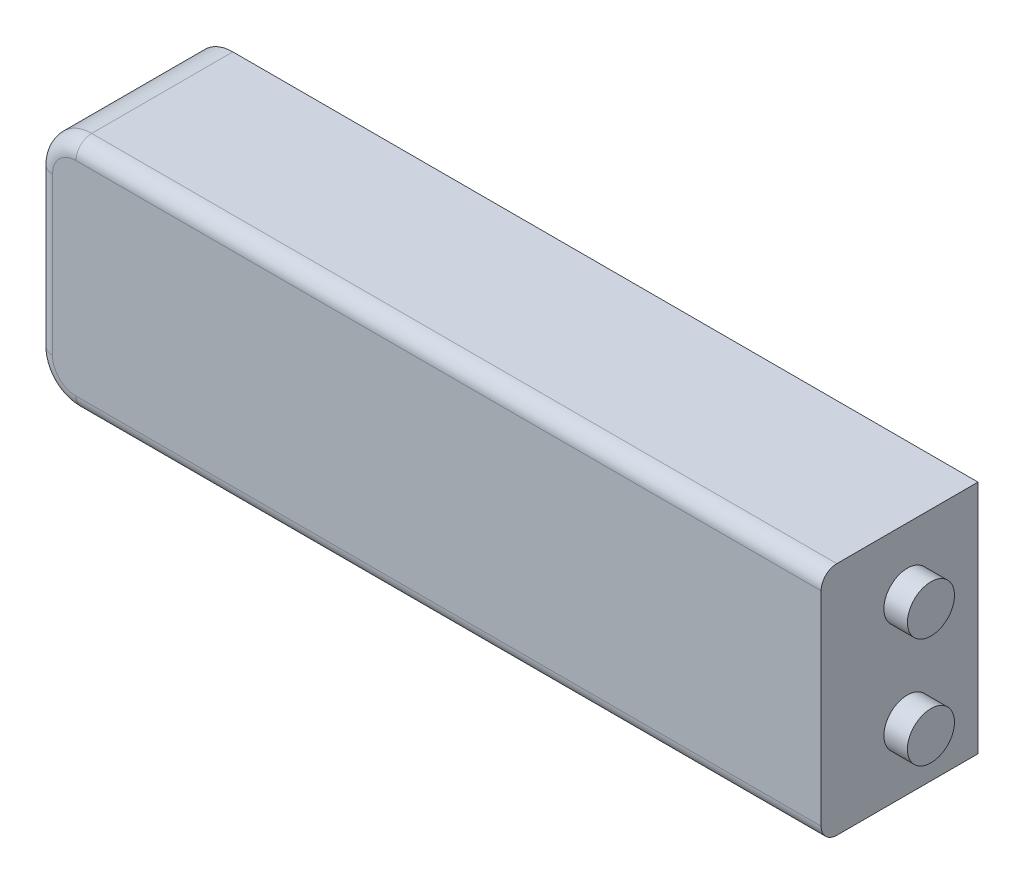
from build123d import *

# Parameters (mm, degrees)
BOSS_EXTRUDE1_DEPTH = 20
SKETCH3_R           = 3
BOSS_EXTRUDE3_DEPTH = 3
FILLET2_R           = 2


with BuildPart() as part:
    # Sketch1 → Boss-Extrude1 (new body)
    with BuildSketch(Plane.XY):
        with BuildLine():
            Line((0, 0), (-95, 0))
            ThreePointArc((-95, 0), (-98.535533906, 1.464466094), (-100, 5))
            Line((-100, 5), (-100, 25))
            ThreePointArc((-100, 25), (-98.535533906, 28.535533906), (-95, 30))
            Line((-95, 30), (0, 30))
            Line((0, 30), (0, 0))
        make_face()
    extrude(amount=BOSS_EXTRUDE1_DEPTH)

    # Sketch3 → Boss-Extrude3 (add)
    with BuildSketch(Plane(origin=(0, 0, 0), x_dir=(0, 0, -1), z_dir=(1, 0, 0))):
        with Locations(Location((-9, 22, 0), (0, 0, 180))):
            Circle(SKETCH3_R)
        with Locations(Location((-9, 8, 0), (0, 0, 180))):
            Circle(SKETCH3_R)
    extrude(amount=BOSS_EXTRUDE3_DEPTH)

    # Fillet2
    fillet2_edges = [part.edges().sort_by_distance(p)[0] for p in [
        (-98.535533906, 28.535533906, 20),
        (-100, 15, 20),
        (-98.535533906, 1.464466094, 20),
        (-47.5, 0, 20),
        (-47.5, 30, 20),
    ]]
    fillet(fillet2_edges, radius=FILLET2_R)


solid = part.part
